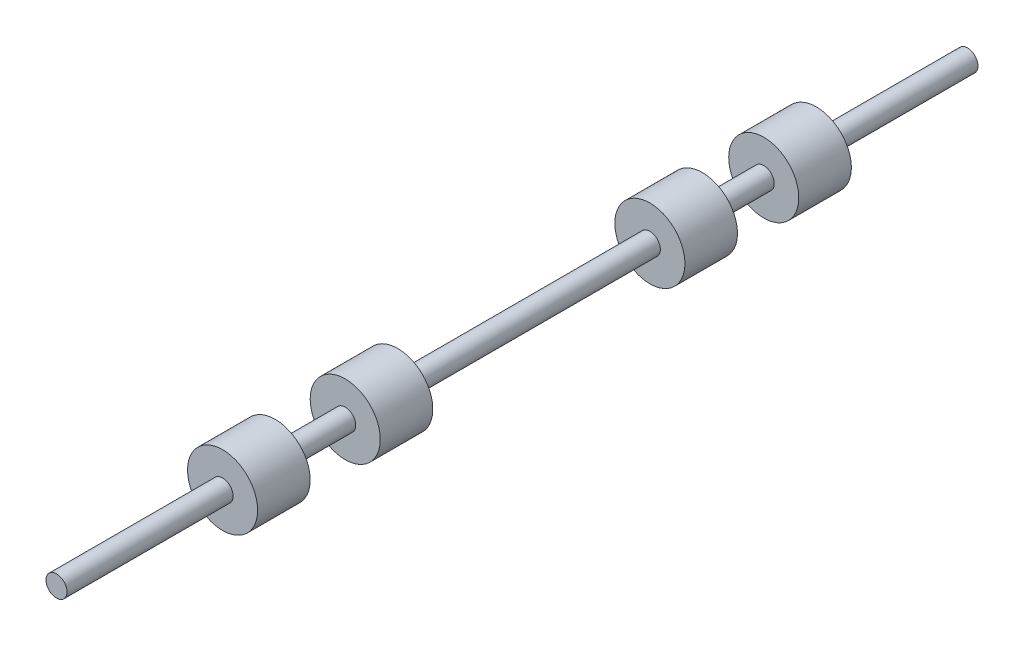
from build123d import *

# Parameters (mm, degrees)
SKETCH1_R           = 0.3
BOSS_EXTRUDE1_DEPTH = 26
SKETCH2_W           = 1
SKETCH2_H           = 1.5


with BuildPart() as part:
    # Sketch1 → Boss-Extrude1 (new body)
    with BuildSketch(Plane.XY):
        Circle(SKETCH1_R)
    extrude(amount=BOSS_EXTRUDE1_DEPTH)

    # Sketch2 → Revolve1 (revolve)
    with BuildSketch(Plane(origin=(0, 0, 0), x_dir=(1, 0, 0), z_dir=(0, 1, 0)), mode=Mode.PRIVATE) as revolve1_sk:
        with Locations((0.5, -5.065012766)):
            Rectangle(SKETCH2_W, SKETCH2_H)
        with Locations((0.5, -8.314987234)):
            Rectangle(SKETCH2_W, SKETCH2_H)
        with Locations((0.5, -17.01)):
            Rectangle(SKETCH2_W, SKETCH2_H)
        with Locations((0.5, -20.51)):
            Rectangle(SKETCH2_W, SKETCH2_H)
    revolve(revolve1_sk.sketch.rotate(Axis((0, 0, 0), (0, 0, 1)), 180), axis=Axis((0, 0, 0), (0, 0, 1)))


solid = part.part
